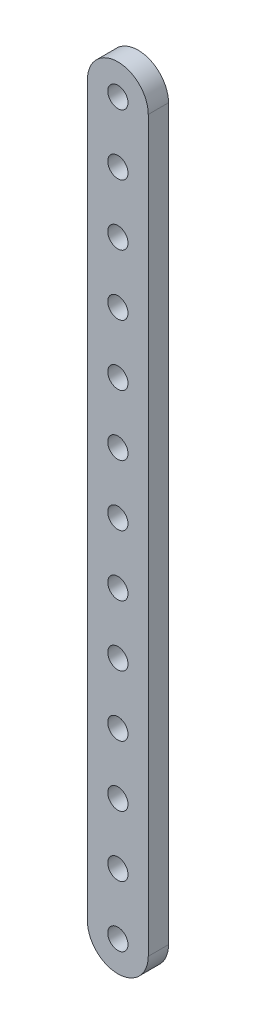
from build123d import *

# Parameters (mm, degrees)
MODEL_R                 = 1.5
SALIENTE_EXTRUIR1_DEPTH = 3


with BuildPart() as part:
    # Model → Saliente-Extruir1 (new body)
    with BuildSketch(Plane.XY):
        with BuildLine():
            Line((213.25077615, 80.428489513), (213.25077615, 188.428489513))
            ThreePointArc((213.25077615, 188.428489513), (208.75077615, 192.928489513), (204.25077615, 188.428489513))
            Line((204.25077615, 188.428489513), (204.25077615, 80.428489513))
            ThreePointArc((204.25077615, 80.428489513), (208.75077615, 75.928489513), (213.25077615, 80.428489513))
        make_face()
        with Locations((208.75077615, 179.428489513)):
            Circle(MODEL_R, mode=Mode.SUBTRACT)
        with Locations((208.75077615, 188.428489513)):
            Circle(MODEL_R, mode=Mode.SUBTRACT)
        with Locations((208.75077615, 152.428489513)):
            Circle(MODEL_R, mode=Mode.SUBTRACT)
        with Locations((208.75077615, 161.428489513)):
            Circle(MODEL_R, mode=Mode.SUBTRACT)
        with Locations((208.75077615, 170.428489513)):
            Circle(MODEL_R, mode=Mode.SUBTRACT)
        with Locations((208.75077615, 143.428489513)):
            Circle(MODEL_R, mode=Mode.SUBTRACT)
        with Locations((208.75077615, 116.428489513)):
            Circle(MODEL_R, mode=Mode.SUBTRACT)
        with Locations((208.75077615, 125.428489513)):
            Circle(MODEL_R, mode=Mode.SUBTRACT)
        with Locations((208.75077615, 134.428489513)):
            Circle(MODEL_R, mode=Mode.SUBTRACT)
        with Locations((208.75077615, 80.428489513)):
            Circle(MODEL_R, mode=Mode.SUBTRACT)
        with Locations((208.75077615, 89.428489513)):
            Circle(MODEL_R, mode=Mode.SUBTRACT)
        with Locations((208.75077615, 98.428489513)):
            Circle(MODEL_R, mode=Mode.SUBTRACT)
        with Locations((208.75077615, 107.428489513)):
            Circle(MODEL_R, mode=Mode.SUBTRACT)
    extrude(amount=SALIENTE_EXTRUIR1_DEPTH)


solid = part.part
